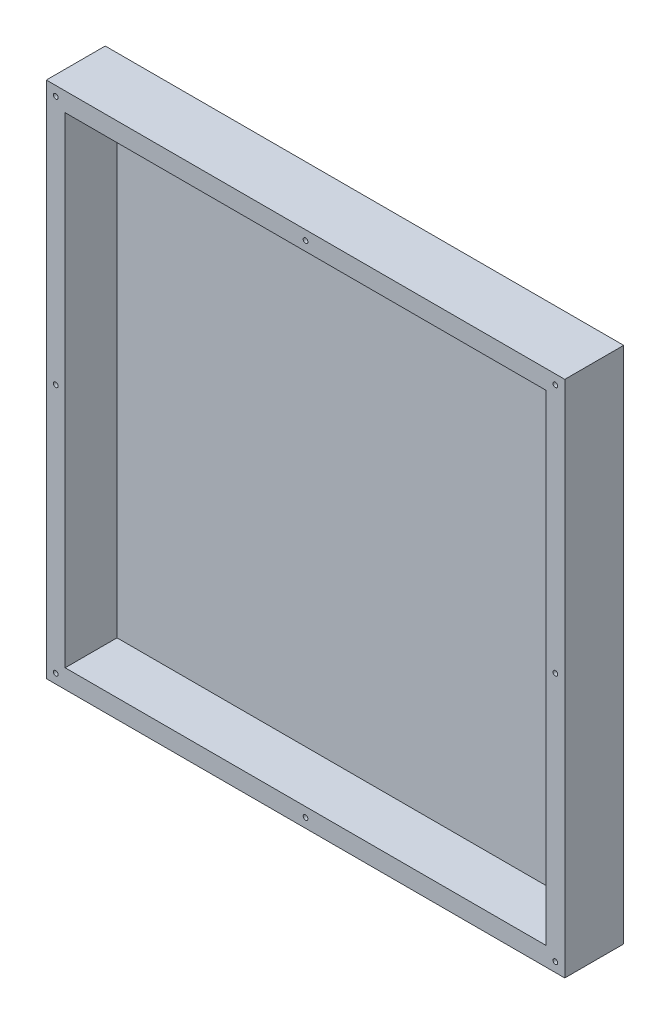
from build123d import *

# Parameters (mm, degrees)
SKETCH1_W           = 220
SKETCH1_H           = 220
BOSS_EXTRUDE1_DEPTH = 3
SKETCH2_W           = 220
SKETCH2_H           = 220
SKETCH2_W_2         = 204
SKETCH2_H_2         = 204
BOSS_EXTRUDE3_DEPTH = 22
SKETCH3_R           = 1
CUT_EXTRUDE1_DEPTH  = 313.1297807


with BuildPart() as part:
    # Sketch1 → Boss-Extrude1 (new body)
    with BuildSketch(Plane.XY):
        with Locations((110, 110)):
            Rectangle(SKETCH1_W, SKETCH1_H)
    extrude(amount=BOSS_EXTRUDE1_DEPTH)

    # Sketch2 → Boss-Extrude3 (add)
    with BuildSketch(Plane.XY.offset(3)):
        with Locations((110, 110)):
            Rectangle(SKETCH2_W, SKETCH2_H)
        with Locations((110, 110)):
            Rectangle(SKETCH2_W_2, SKETCH2_H_2, mode=Mode.SUBTRACT)
    extrude(amount=BOSS_EXTRUDE3_DEPTH)

    # Sketch3 → Cut-Extrude1 (cut, through all)
    with BuildSketch(Plane.XY.offset(25)):
        with Locations((4, 216)):
            Circle(SKETCH3_R)
        with Locations((110, 216)):
            Circle(SKETCH3_R)
        with Locations((216, 216)):
            Circle(SKETCH3_R)
        with Locations((216, 110)):
            Circle(SKETCH3_R)
        with Locations((216, 4)):
            Circle(SKETCH3_R)
        with Locations((110, 4)):
            Circle(SKETCH3_R)
        with Locations((4, 4)):
            Circle(SKETCH3_R)
        with Locations((4, 110)):
            Circle(SKETCH3_R)
    extrude(amount=-CUT_EXTRUDE1_DEPTH, mode=Mode.SUBTRACT)


solid = part.part
